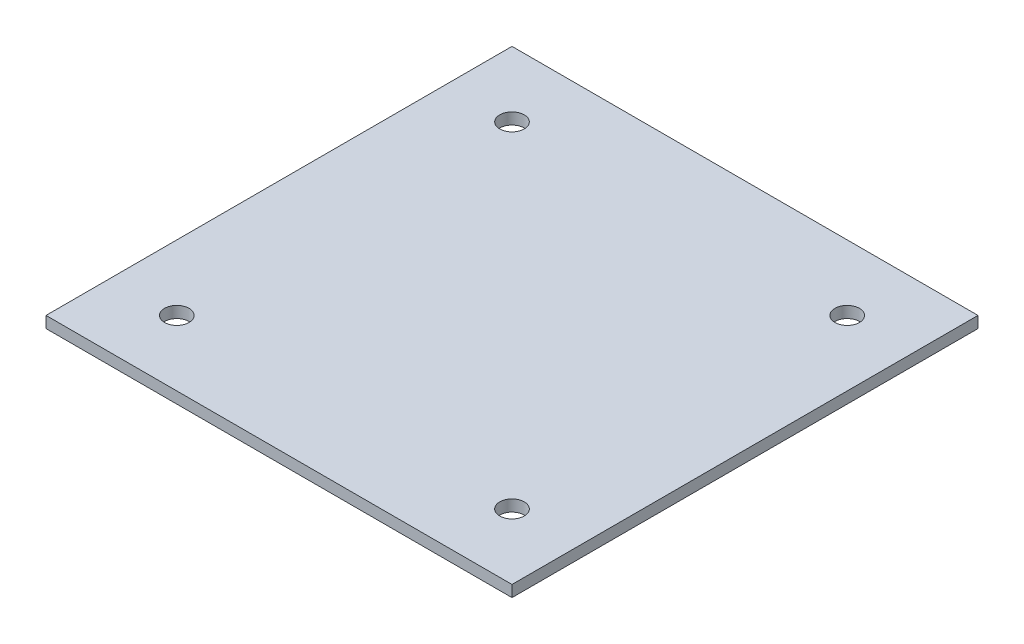
from build123d import *

# Parameters (mm, degrees)
SKETCH1_W           = 57
SKETCH1_H           = 57
SKETCH1_R           = 1.5
SKETCH1_W_2         = 25
SKETCH1_H_2         = 25
BOSS_EXTRUDE1_DEPTH = 1.397


with BuildPart() as part:
    # Sketch1 → Boss-Extrude1 (new body)
    # profile 1 of 2: a face of its own
    with BuildSketch(Plane(origin=(0, 0, 0), x_dir=(1, 0, 0), z_dir=(0, 1, 0))):
        Rectangle(SKETCH1_W, SKETCH1_H)
        with Locations(Location((-20.5, -20.5, 0), (0, 0, 270))):
            Circle(SKETCH1_R, mode=Mode.SUBTRACT)
        with Locations(Location((-20.5, 20.5, 0), (0, 0, 270))):
            Circle(SKETCH1_R, mode=Mode.SUBTRACT)
        with Locations(Location((20.5, -20.5, 0), (0, 0, 270))):
            Circle(SKETCH1_R, mode=Mode.SUBTRACT)
        with Locations(Location((20.5, 20.5, 0), (0, 0, 270))):
            Circle(SKETCH1_R, mode=Mode.SUBTRACT)
        Rectangle(SKETCH1_W_2, SKETCH1_H_2, mode=Mode.SUBTRACT)
    # profile 2 of 2: a face of its own
    with BuildSketch(Plane(origin=(0, 0, 0), x_dir=(1, 0, 0), z_dir=(0, 1, 0))):
        Rectangle(SKETCH1_W_2, SKETCH1_H_2)
    extrude(amount=BOSS_EXTRUDE1_DEPTH)


solid = part.part
